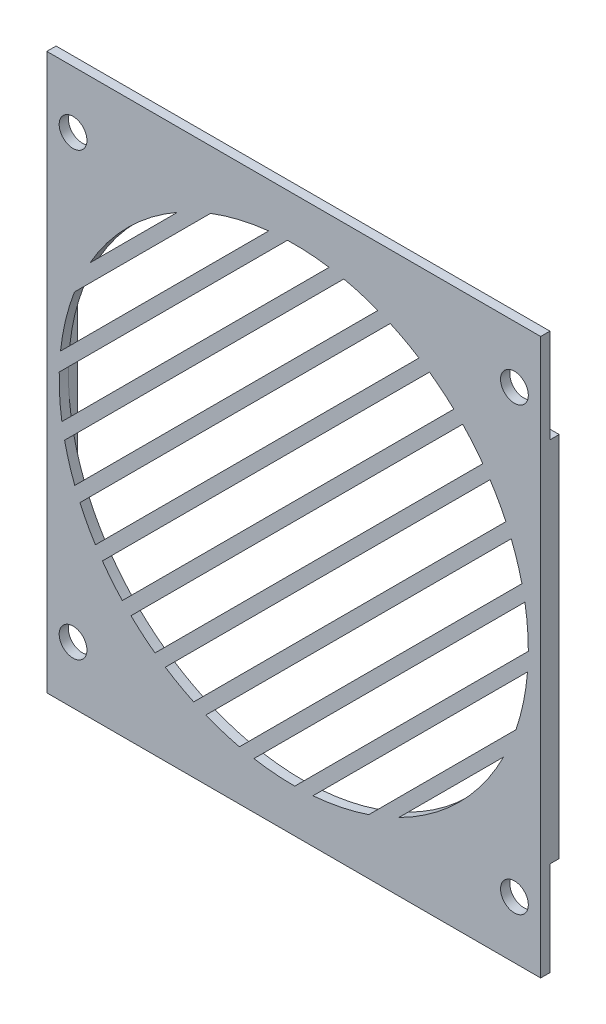
from build123d import *

# Parameters (mm, degrees)
SKETCH5_W            = 80
SKETCH5_H            = 90
BOSS_EXTRUDE2_DEPTH  = 1.5
M4_CLEARANCE_HOLE2_D = 4.5
SKETCH8_R            = 38
CUT_EXTRUDE1_DEPTH   = 2
BOSS_EXTRUDE3_DEPTH  = 1.5
SKETCH10_W           = 2
SKETCH10_H           = 59.5
BOSS_EXTRUDE4_DEPTH  = 1.5


with BuildPart() as part:
    # Sketch5 → Boss-Extrude2 (new body)
    with BuildSketch(Plane.XY):
        Rectangle(SKETCH5_W, SKETCH5_H)
    extrude(amount=BOSS_EXTRUDE2_DEPTH)

    # M4 Clearance Hole2 (through all)
    with Locations(Plane.XY.offset(1.5)):
        with Locations((35.75, 35.75), (-35.75, -35.75), (-35.75, 35.75), (35.75, -35.75)):
            Hole(M4_CLEARANCE_HOLE2_D / 2)

    # Sketch8 → Cut-Extrude1 (cut)
    with BuildSketch(Plane.XY.offset(1.5)):
        Circle(SKETCH8_R)
    extrude(amount=-CUT_EXTRUDE1_DEPTH, mode=Mode.SUBTRACT)

    # Sketch9 → Boss-Extrude3 (add)
    with BuildSketch(Plane.XY.offset(1.5)):
        with BuildLine():
            Line((-18.828232369, 33.007539531), (-33.007539531, 18.828232369))
            ThreePointArc((-33.007539531, 18.828232369), (-34.372809901, 16.202158483), (-35.52955283, 13.477791945))
            Line((-35.52955283, 13.477791945), (-13.477791945, 35.52955283))
            ThreePointArc((-13.477791945, 35.52955283), (-16.202158483, 34.372809901), (-18.828232369, 33.007539531))
        make_face()
        with BuildLine():
            Line((-4.052476159, 37.78329574), (-37.78329574, 4.052476159))
            ThreePointArc((-37.78329574, 4.052476159), (-37.915095853, 2.538800193), (-37.986279438, 1.021065336))
            Line((-37.986279438, 1.021065336), (-1.021065336, 37.986279438))
            ThreePointArc((-1.021065336, 37.986279438), (-2.538800193, 37.915095853), (-4.052476159, 37.78329574))
        make_face()
        with BuildLine():
            Line((5.729767662, 37.565539561), (-37.565539561, -5.729767662))
            ThreePointArc((-37.565539561, -5.729767662), (-37.363427276, -6.926348402), (-37.123210121, -8.115865346))
            Line((-37.123210121, -8.115865346), (8.115865346, 37.123210121))
            ThreePointArc((8.115865346, 37.123210121), (6.926348402, 37.363427276), (5.729767662, 37.565539561))
        make_face()
        with BuildLine():
            Line((13.634094956, 35.469866855), (-35.469866855, -13.634094956))
            ThreePointArc((-35.469866855, -13.634094956), (-35.067590884, -14.637761769), (-34.636921504, -15.629576729))
            Line((-34.636921504, -15.629576729), (15.629576729, 34.636921504))
            ThreePointArc((15.629576729, 34.636921504), (14.637761769, 35.067590884), (13.634094956, 35.469866855))
        make_face()
        with BuildLine():
            Line((20.292391155, 32.128163054), (-32.128163054, -20.292391155))
            ThreePointArc((-32.128163054, -20.292391155), (-31.572249627, -21.146939577), (-30.993612648, -21.986267874))
            Line((-30.993612648, -21.986267874), (21.986267874, 30.993612648))
            ThreePointArc((21.986267874, 30.993612648), (21.146939577, 31.572249627), (20.292391155, 32.128163054))
        make_face()
        with BuildLine():
            Line((25.936489585, 27.772261485), (-27.772261485, -25.936489585))
            ThreePointArc((-27.772261485, -25.936489585), (-27.080082578, -26.658378187), (-26.369145748, -27.361800973))
            Line((-26.369145748, -27.361800973), (27.361800973, 26.369145748))
            ThreePointArc((27.361800973, 26.369145748), (26.658378187, 27.080082578), (25.936489585, 27.772261485))
        make_face()
        with BuildLine():
            Line((30.64028313, 22.47605503), (-22.47605503, -30.64028313))
            ThreePointArc((-22.47605503, -30.64028313), (-21.648561438, -31.230430475), (-20.805580736, -31.798235961))
            Line((-20.805580736, -31.798235961), (31.798235961, 20.805580736))
            ThreePointArc((31.798235961, 20.805580736), (31.230430475, 21.648561438), (30.64028313, 22.47605503))
        make_face()
        with BuildLine():
            Line((34.370751902, 16.206523801), (-16.206523801, -34.370751902))
            ThreePointArc((-16.206523801, -34.370751902), (-15.228749713, -34.815013747), (-14.238811494, -35.23146672))
            Line((-14.238811494, -35.23146672), (35.23146672, 14.238811494))
            ThreePointArc((35.23146672, 14.238811494), (34.815013747, 15.228749713), (34.370751902, 16.206523801))
        make_face()
        with BuildLine():
            Line((36.966476918, 8.802248818), (-8.802248818, -36.966476918))
            ThreePointArc((-8.802248818, -36.966476918), (-7.632453052, -37.225604903), (-6.455069393, -37.447724619))
            Line((-6.455069393, -37.447724619), (37.447724619, 6.455069393))
            ThreePointArc((37.447724619, 6.455069393), (37.225604903, 7.632453052), (36.966476918, 8.802248818))
        make_face()
        with BuildLine():
            Line((37.999643576, -0.164584524), (0.164584524, -37.999643576))
            ThreePointArc((0.164584524, -37.999643576), (1.644059958, -37.964418432), (3.121041877, -37.871613348))
            Line((3.121041877, -37.871613348), (37.871613348, -3.121041877))
            ThreePointArc((37.871613348, -3.121041877), (37.964418432, -1.644059958), (37.999643576, -0.164584524))
        make_face()
        with BuildLine():
            Line((36.000661901, -12.1635662), (12.1635662, -36.000661901))
            ThreePointArc((12.1635662, -36.000661901), (14.624168706, -35.073261748), (17.014742957, -33.977912268))
            Line((17.014742957, -33.977912268), (33.977912268, -17.014742957))
            ThreePointArc((33.977912268, -17.014742957), (35.073261748, -14.624168706), (36.000661901, -12.1635662))
        make_face()
    extrude(amount=-BOSS_EXTRUDE3_DEPTH)

    # Sketch10 → Boss-Extrude4 (add)
    with BuildSketch(Plane(origin=(0, 0, 0), x_dir=(-1, 0, 0), z_dir=(0, 0, -1))):
        with Locations((-39, 0)):
            Rectangle(SKETCH10_W, SKETCH10_H)
        with Locations((39, 0)):
            Rectangle(SKETCH10_W, SKETCH10_H)
    extrude(amount=BOSS_EXTRUDE4_DEPTH)


solid = part.part
